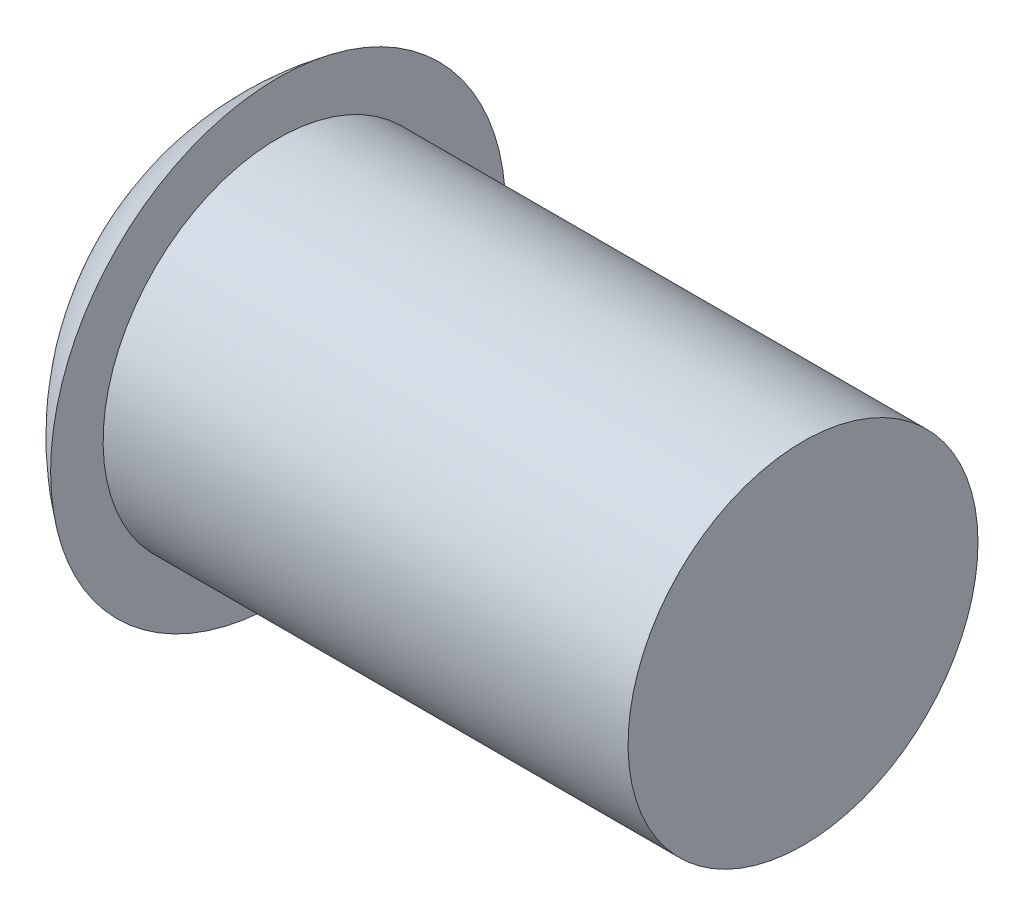
from build123d import *

# Parameters (mm, degrees)
SKETCH1_R           = 5
BOSS_EXTRUDE1_DEPTH = 15


with BuildPart() as part:
    # Sketch1 → Boss-Extrude1 (new body)
    with BuildSketch(Plane(origin=(0, 0, 0), x_dir=(0, 0, -1), z_dir=(1, 0, 0))):
        Circle(SKETCH1_R)
    extrude(amount=BOSS_EXTRUDE1_DEPTH)

    # Sketch3 → Revolve1 (revolve)
    with BuildSketch(Plane.XY, mode=Mode.PRIVATE) as revolve1_sk:
        with BuildLine():
            Line((0, 0), (0, 6.5))
            ThreePointArc((0, 6.5), (-2.427753351, 3.644859394), (-3.3, 0))
            Line((-3.3, 0), (0, 0))
        make_face()
    revolve(revolve1_sk.sketch.rotate(Axis((-3.3, 0, 0), (1, 0, 0)), 180), axis=Axis((-3.3, 0, 0), (1, 0, 0)))


solid = part.part
